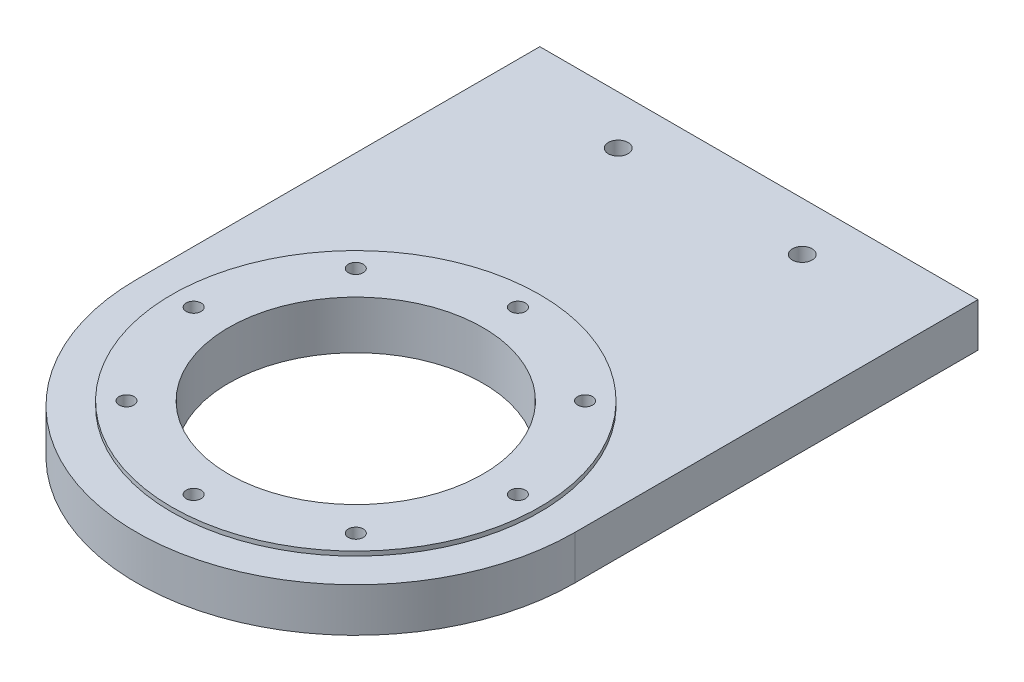
from build123d import *

# Parameters (mm, degrees)
PARED_START                  = -39.75
SK_PARED_W                   = 100
SK_PARED_H                   = 92
PARED_DEPTH                  = 10
CABEZA_START                 = -39.75
SK_CABEZA_R                  = 50
CABEZA_DEPTH                 = 10
ASIENTO_1MM_START            = -29.75
SK_ASIENTO_1MM_R             = 42
SK_ASIENTO_1MM_R_2           = 29
ASIENTO_1MM_DEPTH            = 1
PASO_BOSS_J2_START           = -39.75
SK_PASO_BOSS_J2_R            = 29
PASO_BOSS_J2_DEPTH           = 11
PASANTES_M3_ESTATOR_J2_START = -39.75
SK_PASANTES_M3_ESTATOR_J2_R  = 1.7
PASANTES_M3_ESTATOR_J2_DEPTH = 11
PASANTES_M4_ANGULOS_START    = -39.75
SK_PASANTES_M4_ANGULOS_R     = 2.25
PASANTES_M4_ANGULOS_DEPTH    = 10


with BuildPart() as part:
    # Sk_Pared → Pared (new body)
    with BuildSketch(Plane(origin=(0, 0, 0), x_dir=(1, 0, 0), z_dir=(0, 1, 0)).offset(PARED_START)):
        with Locations((0, -124)):
            Rectangle(SK_PARED_W, SK_PARED_H)
    extrude(amount=PARED_DEPTH)

    # Sk_Cabeza → Cabeza (add)
    with BuildSketch(Plane(origin=(0, 0, 0), x_dir=(1, 0, 0), z_dir=(0, 1, 0)).offset(CABEZA_START)):
        with Locations((0, -170)):
            Circle(SK_CABEZA_R)
    extrude(amount=CABEZA_DEPTH)

    # Sk_Asiento_1mm → Asiento_1mm (add)
    with BuildSketch(Plane(origin=(0, 0, 0), x_dir=(1, 0, 0), z_dir=(0, 1, 0)).offset(ASIENTO_1MM_START)):
        with Locations(Location((0, -170, 0), (0, 0, 270))):
            Circle(SK_ASIENTO_1MM_R)
        with Locations(Location((0, -170, 0), (0, 0, 270))):
            Circle(SK_ASIENTO_1MM_R_2, mode=Mode.SUBTRACT)
    extrude(amount=ASIENTO_1MM_DEPTH)

    # Sk_Paso_boss_J2 → Paso_boss_J2 (cut)
    with BuildSketch(Plane(origin=(0, 0, 0), x_dir=(1, 0, 0), z_dir=(0, 1, 0)).offset(PASO_BOSS_J2_START)):
        with Locations(Location((0, -170, 0), (0, 0, 270))):
            Circle(SK_PASO_BOSS_J2_R)
    extrude(amount=PASO_BOSS_J2_DEPTH, mode=Mode.SUBTRACT)

    # Sk_Pasantes_M3_estator_J2 → Pasantes_M3_estator_J2 (cut)
    with BuildSketch(Plane(origin=(0, 0, 0), x_dir=(1, 0, 0), z_dir=(0, 1, 0)).offset(PASANTES_M3_ESTATOR_J2_START)):
        with Locations(Location((37, -170, 0), (0, 0, 270))):
            Circle(SK_PASANTES_M3_ESTATOR_J2_R)
        with Locations(Location((26.162950904, -196.162950904, 0), (0, 0, 270))):
            Circle(SK_PASANTES_M3_ESTATOR_J2_R)
        with Locations(Location((0, -207, 0), (0, 0, 270))):
            Circle(SK_PASANTES_M3_ESTATOR_J2_R)
        with Locations(Location((-26.162950904, -196.162950904, 0), (0, 0, 270))):
            Circle(SK_PASANTES_M3_ESTATOR_J2_R)
        with Locations(Location((-37, -170, 0), (0, 0, 270))):
            Circle(SK_PASANTES_M3_ESTATOR_J2_R)
        with Locations(Location((-26.162950904, -143.837049096, 0), (0, 0, 270))):
            Circle(SK_PASANTES_M3_ESTATOR_J2_R)
        with Locations(Location((0, -133, 0), (0, 0, 270))):
            Circle(SK_PASANTES_M3_ESTATOR_J2_R)
        with Locations(Location((26.162950904, -143.837049096, 0), (0, 0, 270))):
            Circle(SK_PASANTES_M3_ESTATOR_J2_R)
    extrude(amount=PASANTES_M3_ESTATOR_J2_DEPTH, mode=Mode.SUBTRACT)

    # Sk_Pasantes_M4_angulos → Pasantes_M4_angulos (cut)
    with BuildSketch(Plane(origin=(0, 0, 0), x_dir=(1, 0, 0), z_dir=(0, 1, 0)).offset(PASANTES_M4_ANGULOS_START)):
        with Locations(Location((-21, -89.11, 0), (0, 0, 270))):
            Circle(SK_PASANTES_M4_ANGULOS_R)
        with Locations(Location((21, -89.11, 0), (0, 0, 270))):
            Circle(SK_PASANTES_M4_ANGULOS_R)
    extrude(amount=PASANTES_M4_ANGULOS_DEPTH, mode=Mode.SUBTRACT)


solid = part.part
